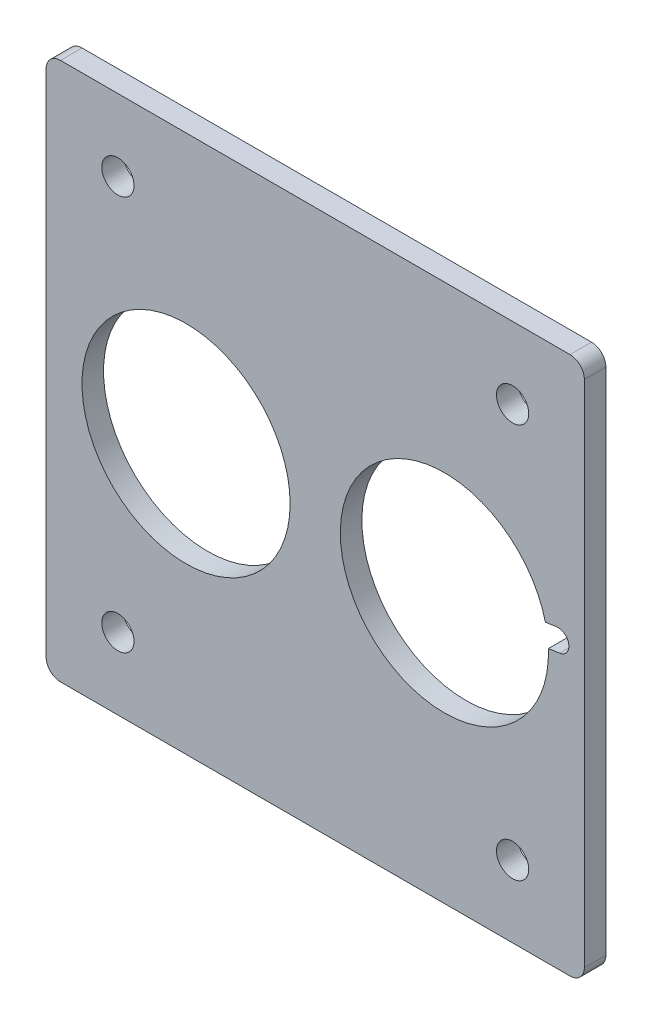
from build123d import *

# Parameters (mm, degrees)
SKIZZE1_W                       = 75
SKIZZE1_H                       = 75
AUFSATZ_LINEAR_AUSTRAGEN1_DEPTH = 3
SKIZZE2_R                       = 14.5
SCHNITT_LINEAR_AUSTRAGEN1_DEPTH = 54.117793629
VERRUNDUNG1_R                   = 2
DURCHGANGSLOCH_F_R_M41_D        = 4.5
SCHNITT_LINEAR_AUSTRAGEN2_DEPTH = 54.117793629


with BuildPart() as part:
    # Skizze1 → Aufsatz-Linear austragen1 (new body)
    with BuildSketch(Plane.XY):
        Rectangle(SKIZZE1_W, SKIZZE1_H)
    extrude(amount=AUFSATZ_LINEAR_AUSTRAGEN1_DEPTH)

    # Skizze2 → Schnitt-Linear austragen1 (cut, through all)
    with BuildSketch(Plane.XY.offset(3)):
        with Locations((-18, 0)):
            Circle(SKIZZE2_R)
        with Locations((18, 0)):
            Circle(SKIZZE2_R)
    extrude(amount=-SCHNITT_LINEAR_AUSTRAGEN1_DEPTH, mode=Mode.SUBTRACT)

    # Verrundung1
    verrundung1_edges = [part.edges().sort_by_distance(p)[0] for p in [
        (37.5, -37.5, 1.5),
        (-37.5, -37.5, 1.5),
        (-37.5, 37.5, 1.5),
        (37.5, 37.5, 1.5),
    ]]
    fillet(verrundung1_edges, radius=VERRUNDUNG1_R)

    # Durchgangsloch für M41 (through all)
    with Locations(Plane.XY.offset(3)):
        with Locations((27.5, 27.5), (-27.5, 27.5)):
            durchgangsloch_f_r_m41 = Hole(DURCHGANGSLOCH_F_R_M41_D / 2)

    # Spiegeln1: Durchgangsloch für M41 across plane
    add(durchgangsloch_f_r_m41.mirror(Plane.ZX), mode=Mode.SUBTRACT)

    # Skizze6 → Schnitt-Linear austragen2 (cut, through all)
    with BuildSketch(Plane.XY.offset(3)):
        with BuildLine():
            Line((17.791240349, 1.485402103), (33.635529448, 3.712171718))
            ThreePointArc((33.635529448, 3.712171718), (35.329691203, 2.435529267), (34.053048751, 0.741367512))
            Line((34.053048751, 0.741367512), (18.208759651, -1.485402103))
            ThreePointArc((18.208759651, -1.485402103), (16.514597897, -0.208759651), (17.791240349, 1.485402103))
        make_face()
    extrude(amount=-SCHNITT_LINEAR_AUSTRAGEN2_DEPTH, mode=Mode.SUBTRACT)


solid = part.part
